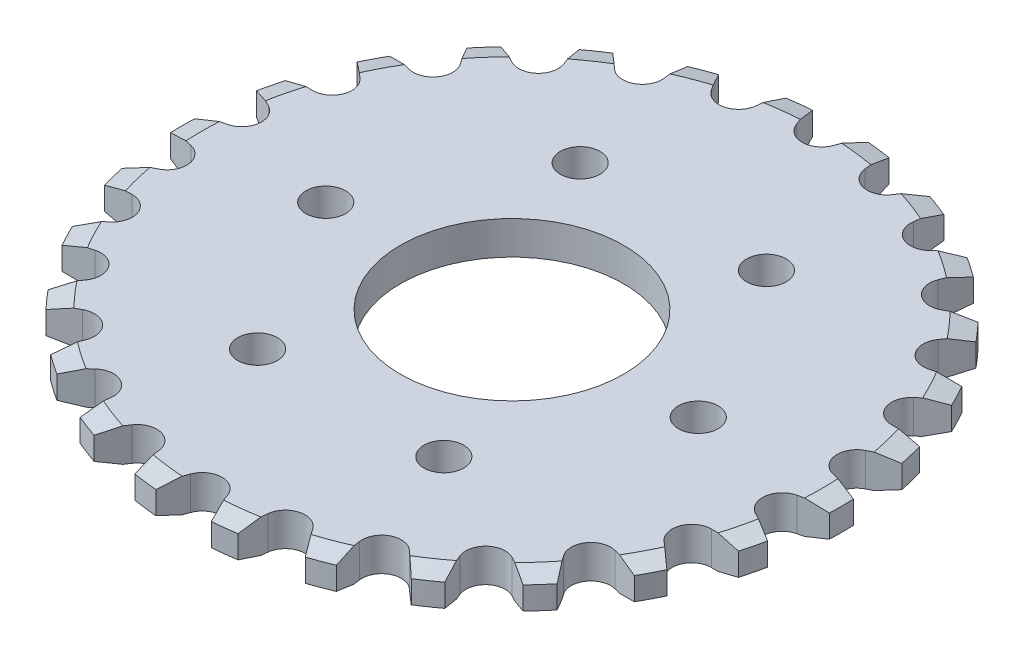
from build123d import *
from OCP.BRepFilletAPI import BRepFilletAPI_MakeChamfer

# Parameters (mm, degrees)
SKETCH1_R           = 42.1386
SKETCH1_R_2         = 14.28115
BOSS_EXTRUDE1_DEPTH = 4.2672
SKETCH2_R           = 2.54
CUT_EXTRUDE1_DEPTH  = 60.74556231
CHAMFER1_SIZE       = 2.54
CHAMFER1_SIZE2      = 0.680590949
CUT_EXTRUDE2_DEPTH  = 60.74556231


with BuildPart() as part:
    # Sketch1 → Boss-Extrude1 (new body)
    with BuildSketch(Plane(origin=(0, 0, 0), x_dir=(1, 0, 0), z_dir=(0, 1, 0))):
        with Locations(Location((0, 0, 0), (0, 0, 270))):
            Circle(SKETCH1_R)
        with Locations(Location((0, 0, 0), (0, 0, 270))):
            Circle(SKETCH1_R_2, mode=Mode.SUBTRACT)
    extrude(amount=BOSS_EXTRUDE1_DEPTH)

    # Sketch2 → Cut-Extrude1 (cut, through all)
    with BuildSketch(Plane(origin=(0, 4.2672, 0), x_dir=(1, 0, 0), z_dir=(0, 1, 0))):
        with Locations(Location((-23.8125, 0, 0), (0, 0, 270))):
            Circle(SKETCH2_R)
        with Locations(Location((-11.90625, 20.622229928, 0), (0, 0, 270))):
            Circle(SKETCH2_R)
        with Locations(Location((11.90625, 20.622229928, 0), (0, 0, 270))):
            Circle(SKETCH2_R)
        with Locations(Location((23.8125, 0, 0), (0, 0, 270))):
            Circle(SKETCH2_R)
        with Locations(Location((11.90625, -20.622229928, 0), (0, 0, 270))):
            Circle(SKETCH2_R)
        with Locations(Location((-11.90625, -20.622229928, 0), (0, 0, 270))):
            Circle(SKETCH2_R)
    extrude(amount=-CUT_EXTRUDE1_DEPTH, mode=Mode.SUBTRACT)

    # Chamfer1: one chamfer whose edges measure the first distance from different faces: ONE call of the kernel's chamfer builder (chamfer() names one face for all edges)
    chamfer1_edges_1 = [part.edges().sort_by_distance(p)[0] for p in [
        (0, 0, -42.1386),
    ]]
    chamfer1_side_1 = [part.faces().sort_by_distance(p)[0] for p in [
        (0, 0, -40.946740408),
    ]]
    chamfer1_edges_2 = [part.edges().sort_by_distance(p)[0] for p in [
        (0, 4.2672, -42.1386),
    ]]
    chamfer1_side_2 = [part.faces().sort_by_distance(p)[0] for p in [
        (0, 4.2672, -40.946740408),
    ]]
    chamfer1 = BRepFilletAPI_MakeChamfer(part.part.solid().wrapped)
    for e in chamfer1_edges_1:
        chamfer1.Add(CHAMFER1_SIZE, CHAMFER1_SIZE2, e.wrapped, chamfer1_side_1[0].wrapped)  # the first distance lies on this face
    for e in chamfer1_edges_2:
        chamfer1.Add(CHAMFER1_SIZE, CHAMFER1_SIZE2, e.wrapped, chamfer1_side_2[0].wrapped)  # the first distance lies on this face
    add(Compound.cast(chamfer1.Shape()), mode=Mode.REPLACE)

    # Sketch3 → Cut-Extrude2 (cut, through all)
    with BuildSketch(Plane(origin=(0, 4.2672, 0), x_dir=(1, 0, 0), z_dir=(0, 1, 0))):
        with BuildLine():
            Line((2.362951064, 38.738556148), (3.546063223, 41.989130088))
            ThreePointArc((3.546063223, 41.989130088), (0, 42.1386), (-3.546063223, 41.989130088))
            Line((-3.546063223, 41.989130088), (-2.362951064, 38.738556148))
            ThreePointArc((-2.362951064, 38.738556148), (0, 37.084), (2.362951064, 38.738556148))
        make_face()
        with BuildLine():
            Line((6.976455297, 38.178375314), (6.60563549, 41.617630756))
            ThreePointArc((6.60563549, 41.617630756), (10.084427051, 40.914128868), (13.49167763, 39.920373804))
            Line((13.49167763, 39.920373804), (11.565031299, 37.047392907))
            ThreePointArc((11.565031299, 37.047392907), (8.874782094, 36.006406357), (6.976455297, 38.178375314))
        make_face()
        with BuildLine():
            Line((15.910415435, 35.39940608), (16.373438678, 38.827465998))
            ThreePointArc((16.373438678, 38.827465998), (19.582783857, 37.311877283), (22.653204774, 35.531590499))
            Line((22.653204774, 35.531590499), (20.094993951, 33.203169852))
            ThreePointArc((20.094993951, 33.203169852), (17.233794112, 32.836251255), (15.910415435, 35.39940608))
        make_face()
        with BuildLine():
            Line((23.91972006, 30.563152036), (25.189677125, 33.780790048))
            ThreePointArc((25.189677125, 33.780790048), (27.943060447, 31.541195013), (30.498209998, 29.077840307))
            Line((30.498209998, 29.077840307), (27.457108598, 27.429299254))
            ThreePointArc((27.457108598, 27.429299254), (24.591240658, 27.757772585), (23.91972006, 30.563152036))
        make_face()
        with BuildLine():
            Line((30.5388975, 23.950678688), (32.541983099, 26.770897369))
            ThreePointArc((32.541983099, 26.770897369), (34.679387931, 23.937453137), (36.570770112, 20.934191729))
            Line((36.570770112, 20.934191729), (33.223515895, 20.061337485))
            ThreePointArc((33.223515895, 20.061337485), (30.519533683, 21.066113068), (30.5388975, 23.950678688))
        make_face()
        with BuildLine():
            Line((35.383265221, 15.946278953), (38.0030673, 18.205177443))
            ThreePointArc((38.0030673, 18.205177443), (39.400275444, 14.942553493), (40.517969997, 11.573924021))
            Line((40.517969997, 11.573924021), (37.059093211, 11.527483701))
            ThreePointArc((37.059093211, 11.527483701), (34.674142344, 13.150167631), (35.383265221, 15.946278953))
        make_face()
        with BuildLine():
            Line((38.171286181, 7.015139446), (41.255551366, 8.581438777))
            ThreePointArc((41.255551366, 8.581438777), (41.831362162, 5.079246955), (42.110412743, 1.541021918))
            Line((42.110412743, 1.541021918), (38.740930734, 2.323694465))
            ThreePointArc((38.740930734, 2.323694465), (36.813615887, 4.469982251), (38.171286181, 7.015139446))
        make_face()
        with BuildLine():
            Line((38.740930734, -2.323694465), (42.110412743, -1.541021918))
            ThreePointArc((42.110412743, -1.541021918), (41.831362162, -5.079246955), (41.255551366, -8.581438777))
            Line((41.255551366, -8.581438777), (38.171286181, -7.015139446))
            ThreePointArc((38.171286181, -7.015139446), (36.813615887, -4.469982251), (38.740930734, -2.323694465))
        make_face()
        with BuildLine():
            Line((37.059093211, -11.527483701), (40.517969997, -11.573924021))
            ThreePointArc((40.517969997, -11.573924021), (39.400275444, -14.942553493), (38.0030673, -18.205177443))
            Line((38.0030673, -18.205177443), (35.383265221, -15.946278953))
            ThreePointArc((35.383265221, -15.946278953), (34.674142344, -13.150167631), (37.059093211, -11.527483701))
        make_face()
        with BuildLine():
            Line((33.223515895, -20.061337485), (36.570770112, -20.934191729))
            ThreePointArc((36.570770112, -20.934191729), (34.679387931, -23.937453137), (32.541983099, -26.770897369))
            Line((32.541983099, -26.770897369), (30.5388975, -23.950678688))
            ThreePointArc((30.5388975, -23.950678688), (30.519533683, -21.066113068), (33.223515895, -20.061337485))
        make_face()
        with BuildLine():
            Line((27.457108598, -27.429299254), (30.498209998, -29.077840307))
            ThreePointArc((30.498209998, -29.077840307), (27.943060447, -31.541195013), (25.189677125, -33.780790048))
            Line((25.189677125, -33.780790048), (23.91972006, -30.563152036))
            ThreePointArc((23.91972006, -30.563152036), (24.591240658, -27.757772585), (27.457108598, -27.429299254))
        make_face()
        with BuildLine():
            Line((20.094993951, -33.203169852), (22.653204774, -35.531590499))
            ThreePointArc((22.653204774, -35.531590499), (19.582783857, -37.311877283), (16.373438678, -38.827465998))
            Line((16.373438678, -38.827465998), (15.910415435, -35.39940608))
            ThreePointArc((15.910415435, -35.39940608), (17.233794112, -32.836251255), (20.094993951, -33.203169852))
        make_face()
        with BuildLine():
            Line((11.565031299, -37.047392907), (13.49167763, -39.920373804))
            ThreePointArc((13.49167763, -39.920373804), (10.084427051, -40.914128868), (6.60563549, -41.617630756))
            Line((6.60563549, -41.617630756), (6.976455297, -38.178375314))
            ThreePointArc((6.976455297, -38.178375314), (8.874782094, -36.006406357), (11.565031299, -37.047392907))
        make_face()
        with BuildLine():
            Line((2.362951064, -38.738556148), (3.546063223, -41.989130088))
            ThreePointArc((3.546063223, -41.989130088), (0, -42.1386), (-3.546063223, -41.989130088))
            Line((-3.546063223, -41.989130088), (-2.362951064, -38.738556148))
            ThreePointArc((-2.362951064, -38.738556148), (0, -37.084), (2.362951064, -38.738556148))
        make_face()
        with BuildLine():
            Line((-6.976455297, -38.178375314), (-6.60563549, -41.617630756))
            ThreePointArc((-6.60563549, -41.617630756), (-10.084427051, -40.914128868), (-13.49167763, -39.920373804))
            Line((-13.49167763, -39.920373804), (-11.565031299, -37.047392907))
            ThreePointArc((-11.565031299, -37.047392907), (-8.874782094, -36.006406357), (-6.976455297, -38.178375314))
        make_face()
        with BuildLine():
            Line((-15.910415435, -35.39940608), (-16.373438678, -38.827465998))
            ThreePointArc((-16.373438678, -38.827465998), (-19.582783857, -37.311877283), (-22.653204774, -35.531590499))
            Line((-22.653204774, -35.531590499), (-20.094993951, -33.203169852))
            ThreePointArc((-20.094993951, -33.203169852), (-17.233794112, -32.836251255), (-15.910415435, -35.39940608))
        make_face()
        with BuildLine():
            Line((-23.91972006, -30.563152036), (-25.189677125, -33.780790048))
            ThreePointArc((-25.189677125, -33.780790048), (-27.943060447, -31.541195013), (-30.498209998, -29.077840307))
            Line((-30.498209998, -29.077840307), (-27.457108598, -27.429299254))
            ThreePointArc((-27.457108598, -27.429299254), (-24.591240658, -27.757772585), (-23.91972006, -30.563152036))
        make_face()
        with BuildLine():
            Line((-30.5388975, -23.950678688), (-32.541983099, -26.770897369))
            ThreePointArc((-32.541983099, -26.770897369), (-34.679387931, -23.937453137), (-36.570770112, -20.934191729))
            Line((-36.570770112, -20.934191729), (-33.223515895, -20.061337485))
            ThreePointArc((-33.223515895, -20.061337485), (-30.519533683, -21.066113068), (-30.5388975, -23.950678688))
        make_face()
        with BuildLine():
            Line((-35.383265221, -15.946278953), (-38.0030673, -18.205177443))
            ThreePointArc((-38.0030673, -18.205177443), (-39.400275444, -14.942553493), (-40.517969997, -11.573924021))
            Line((-40.517969997, -11.573924021), (-37.059093211, -11.527483701))
            ThreePointArc((-37.059093211, -11.527483701), (-34.674142344, -13.150167631), (-35.383265221, -15.946278953))
        make_face()
        with BuildLine():
            Line((-38.171286181, -7.015139446), (-41.255551366, -8.581438777))
            ThreePointArc((-41.255551366, -8.581438777), (-41.831362162, -5.079246955), (-42.110412743, -1.541021918))
            Line((-42.110412743, -1.541021918), (-38.740930734, -2.323694465))
            ThreePointArc((-38.740930734, -2.323694465), (-36.813615887, -4.469982251), (-38.171286181, -7.015139446))
        make_face()
        with BuildLine():
            Line((-38.740930734, 2.323694465), (-42.110412743, 1.541021918))
            ThreePointArc((-42.110412743, 1.541021918), (-41.831362162, 5.079246955), (-41.255551366, 8.581438777))
            Line((-41.255551366, 8.581438777), (-38.171286181, 7.015139446))
            ThreePointArc((-38.171286181, 7.015139446), (-36.813615887, 4.469982251), (-38.740930734, 2.323694465))
        make_face()
        with BuildLine():
            Line((-37.059093211, 11.527483701), (-40.517969997, 11.573924021))
            ThreePointArc((-40.517969997, 11.573924021), (-39.400275444, 14.942553493), (-38.0030673, 18.205177443))
            Line((-38.0030673, 18.205177443), (-35.383265221, 15.946278953))
            ThreePointArc((-35.383265221, 15.946278953), (-34.674142344, 13.150167631), (-37.059093211, 11.527483701))
        make_face()
        with BuildLine():
            Line((-33.223515895, 20.061337485), (-36.570770112, 20.934191729))
            ThreePointArc((-36.570770112, 20.934191729), (-34.679387931, 23.937453137), (-32.541983099, 26.770897369))
            Line((-32.541983099, 26.770897369), (-30.5388975, 23.950678688))
            ThreePointArc((-30.5388975, 23.950678688), (-30.519533683, 21.066113068), (-33.223515895, 20.061337485))
        make_face()
        with BuildLine():
            Line((-27.457108598, 27.429299254), (-30.498209998, 29.077840307))
            ThreePointArc((-30.498209998, 29.077840307), (-27.943060447, 31.541195013), (-25.189677125, 33.780790048))
            Line((-25.189677125, 33.780790048), (-23.91972006, 30.563152036))
            ThreePointArc((-23.91972006, 30.563152036), (-24.591240658, 27.757772585), (-27.457108598, 27.429299254))
        make_face()
        with BuildLine():
            Line((-20.094993951, 33.203169852), (-22.653204774, 35.531590499))
            ThreePointArc((-22.653204774, 35.531590499), (-19.582783857, 37.311877283), (-16.373438678, 38.827465998))
            Line((-16.373438678, 38.827465998), (-15.910415435, 35.39940608))
            ThreePointArc((-15.910415435, 35.39940608), (-17.233794112, 32.836251255), (-20.094993951, 33.203169852))
        make_face()
        with BuildLine():
            Line((-11.565031299, 37.047392907), (-13.49167763, 39.920373804))
            ThreePointArc((-13.49167763, 39.920373804), (-10.084427051, 40.914128868), (-6.60563549, 41.617630756))
            Line((-6.60563549, 41.617630756), (-6.976455297, 38.178375314))
            ThreePointArc((-6.976455297, 38.178375314), (-8.874782094, 36.006406357), (-11.565031299, 37.047392907))
        make_face()
    extrude(amount=-CUT_EXTRUDE2_DEPTH, mode=Mode.SUBTRACT)


solid = part.part
